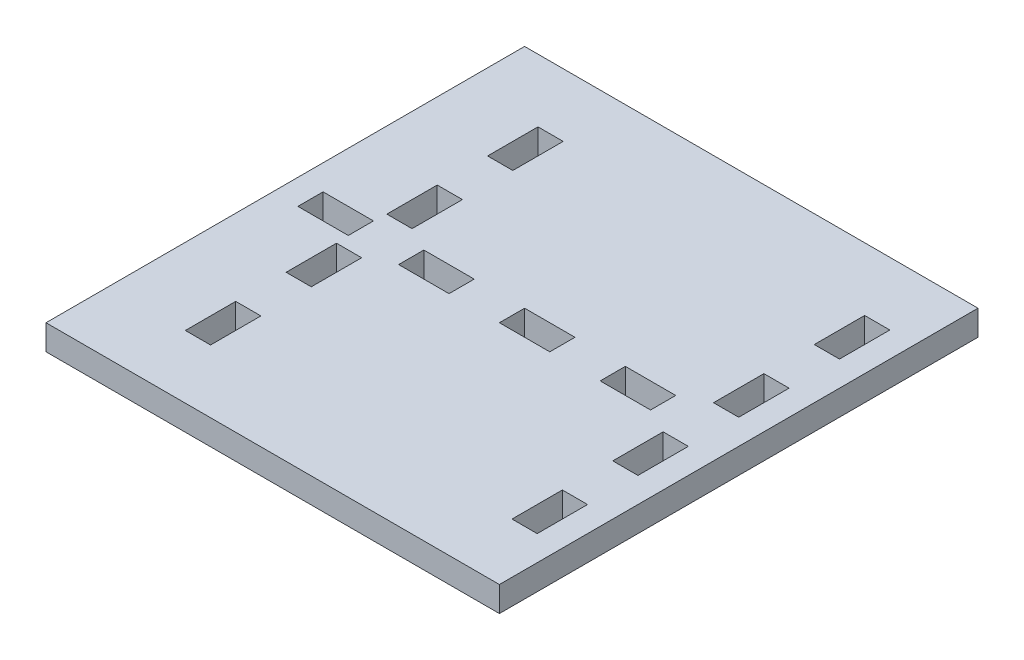
from build123d import *

# Parameters (mm, degrees)
SKETCH1_W           = 57.15
SKETCH1_H           = 60.325
SKETCH1_W_2         = 6.35
SKETCH1_H_2         = 3.175
SKETCH1_W_3         = 3.175
SKETCH1_H_3         = 6.35
BOSS_EXTRUDE1_DEPTH = 3.175


with BuildPart() as part:
    # Sketch1 → Boss-Extrude1 (new body)
    with BuildSketch(Plane(origin=(0, 0, 0), x_dir=(1, 0, 0), z_dir=(0, 1, 0))):
        with Locations((28.575, 30.1625)):
            Rectangle(SKETCH1_W, SKETCH1_H)
        with Locations((44.45, 30.1625)):
            Rectangle(SKETCH1_W_2, SKETCH1_H_2, mode=Mode.SUBTRACT)
        with Locations((52.3875, 36.5125)):
            Rectangle(SKETCH1_W_3, SKETCH1_H_3, mode=Mode.SUBTRACT)
        with Locations((52.3875, 23.8125)):
            Rectangle(SKETCH1_W_3, SKETCH1_H_3, mode=Mode.SUBTRACT)
        with Locations((52.3875, 49.2125)):
            Rectangle(SKETCH1_W_3, SKETCH1_H_3, mode=Mode.SUBTRACT)
        with Locations((52.3875, 11.1125)):
            Rectangle(SKETCH1_W_3, SKETCH1_H_3, mode=Mode.SUBTRACT)
        with Locations((11.2125, 11.1125)):
            Rectangle(SKETCH1_W_3, SKETCH1_H_3, mode=Mode.SUBTRACT)
        with Locations((11.2125, 49.2125)):
            Rectangle(SKETCH1_W_3, SKETCH1_H_3, mode=Mode.SUBTRACT)
        with Locations((11.2125, 36.5125)):
            Rectangle(SKETCH1_W_3, SKETCH1_H_3, mode=Mode.SUBTRACT)
        with Locations((11.2125, 23.8125)):
            Rectangle(SKETCH1_W_3, SKETCH1_H_3, mode=Mode.SUBTRACT)
        with Locations((31.75, 30.1625)):
            Rectangle(SKETCH1_W_2, SKETCH1_H_2, mode=Mode.SUBTRACT)
        with Locations((19.05, 30.1625)):
            Rectangle(SKETCH1_W_2, SKETCH1_H_2, mode=Mode.SUBTRACT)
        with Locations((6.35, 30.1625)):
            Rectangle(SKETCH1_W_2, SKETCH1_H_2, mode=Mode.SUBTRACT)
    extrude(amount=BOSS_EXTRUDE1_DEPTH)


solid = part.part
